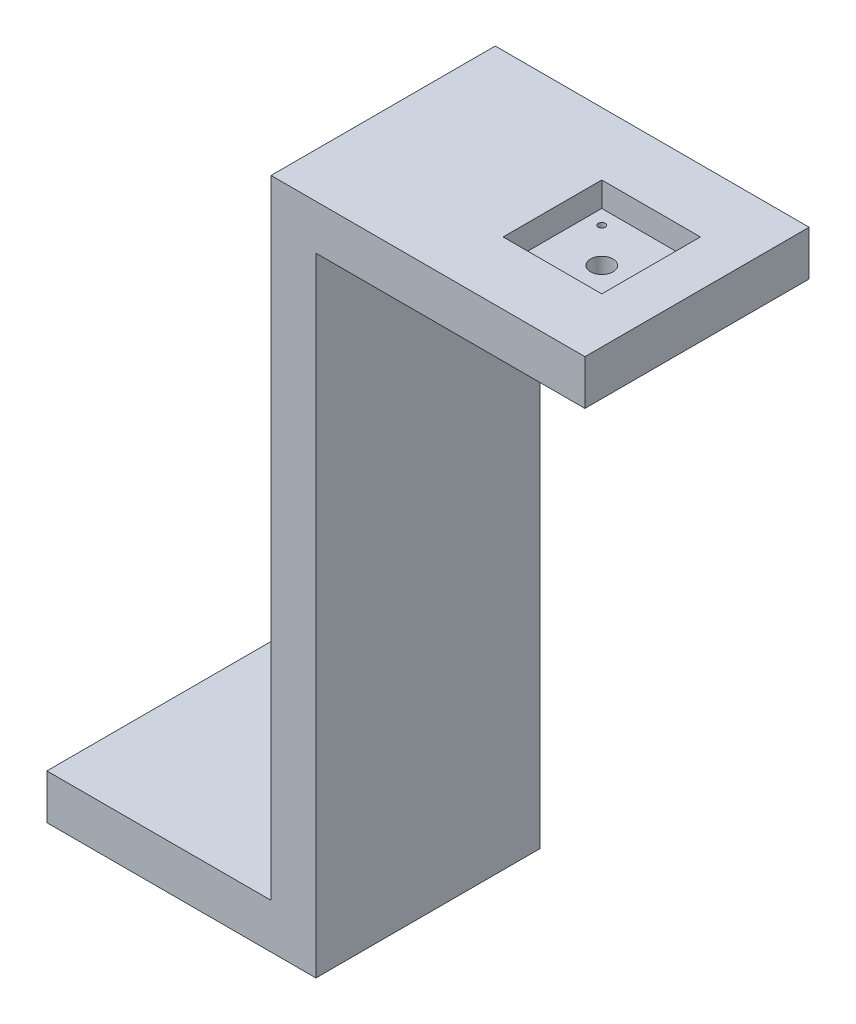
from build123d import *

# Parameters (mm, degrees)
BOSS_EXTRUDE1_DEPTH = 100
SKETCH2_R           = 5
CUT_EXTRUDE1_DEPTH  = 100
SKETCH6_W           = 44
SKETCH6_H           = 44
CUT_EXTRUDE2_DEPTH  = 11
SKETCH7_R           = 1.55
CUT_EXTRUDE3_DEPTH  = 11


with BuildPart() as part:
    # Sketch1 → Boss-Extrude1 (new body)
    with BuildSketch(Plane.XY):
        Polygon((0, 0), (0, 280), (120, 280), (120, 300), (-20, 300), (-20, 20), (-120, 20), (-120, 0), align=None)
    extrude(amount=BOSS_EXTRUDE1_DEPTH)

    # Sketch2 → Cut-Extrude1 (cut)
    with BuildSketch(Plane(origin=(0, 300, 0), x_dir=(1, 0, 0), z_dir=(0, 1, 0))):
        with Locations(Location((77.5, -50, 0), (0, 0, 270))):
            Circle(SKETCH2_R)
    extrude(amount=-CUT_EXTRUDE1_DEPTH, mode=Mode.SUBTRACT)

    # Sketch6 → Cut-Extrude2 (cut)
    with BuildSketch(Plane(origin=(0, 300, 0), x_dir=(1, 0, 0), z_dir=(0, 1, 0))):
        with Locations((77.5, -50)):
            Rectangle(SKETCH6_W, SKETCH6_H)
    extrude(amount=-CUT_EXTRUDE2_DEPTH, mode=Mode.SUBTRACT)

    # Sketch7 → Cut-Extrude3 (cut)
    with BuildSketch(Plane(origin=(0, 289, 0), x_dir=(1, 0, 0), z_dir=(0, 1, 0))):
        with Locations(Location((62, -34.5, 0), (0, 0, 270))):
            Circle(SKETCH7_R)
        with Locations(Location((93, -34.5, 0), (0, 0, 270))):
            Circle(SKETCH7_R)
        with Locations(Location((93, -65.5, 0), (0, 0, 270))):
            Circle(SKETCH7_R)
        with Locations(Location((62, -65.5, 0), (0, 0, 270))):
            Circle(SKETCH7_R)
    extrude(amount=-CUT_EXTRUDE3_DEPTH, mode=Mode.SUBTRACT)


solid = part.part
